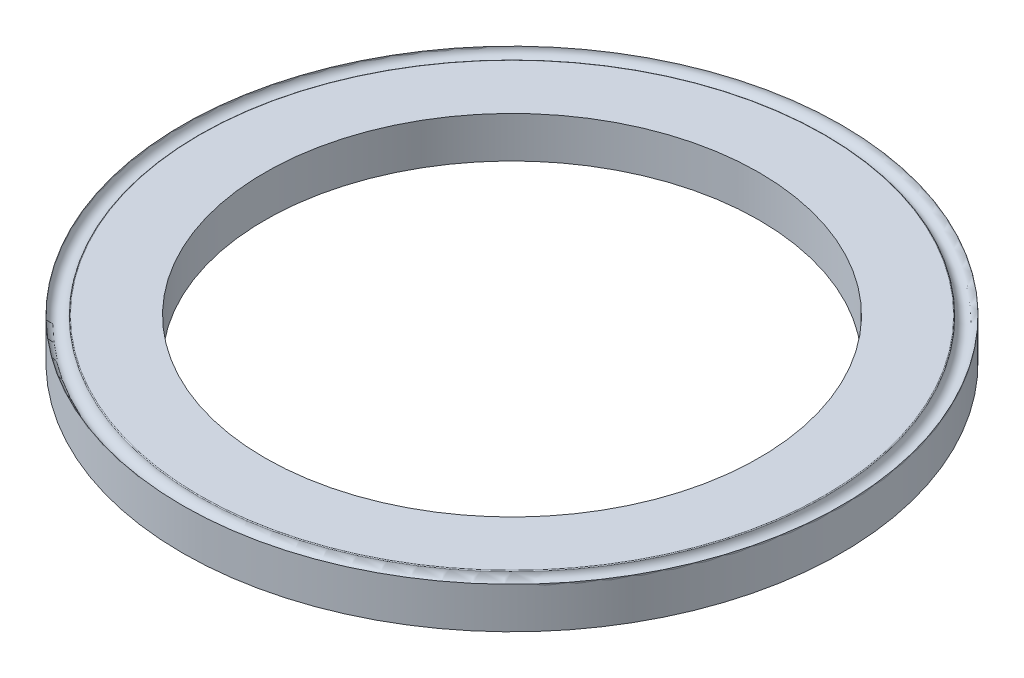
from build123d import *

# Parameters (mm, degrees)
TOP_SKETCH_R   = 4
TOP_SKETCH_R_2 = 3
TOP_DEPTH      = 0.25


with BuildPart() as part:
    # Top Sketch → Top (new, symmetric)
    with BuildSketch(Plane(origin=(0, 0, 0), x_dir=(1, 0, 0), z_dir=(0, 1, 0))):
        with Locations(Location((0, 0, 0), (0, 0, 270))):
            Circle(TOP_SKETCH_R)
        with Locations(Location((0, 0, 0), (0, 0, 270))):
            Circle(TOP_SKETCH_R_2, mode=Mode.SUBTRACT)
    extrude(amount=TOP_DEPTH, both=True)

    # Crimp Sketch → Crimp (revolve, cut)
    with BuildSketch(Plane.XY, mode=Mode.PRIVATE) as crimp_sk:
        with BuildLine():
            Line((-4, 0.25), (-3.790455488, 0.25))
            ThreePointArc((-3.790455488, 0.25), (-3.797197487, 0.247385489), (-3.80041408, 0.240909091))
            ThreePointArc((-3.80041408, 0.240909091), (-3.904550167, 0.150103574), (-4, 0.25))
        make_face()
    revolve(crimp_sk.sketch.rotate(Axis((0, 0.25, 0), (0, -1, 0)), 270), axis=Axis((0, 0.25, 0), (0, -1, 0)), mode=Mode.SUBTRACT)


solid = part.part
